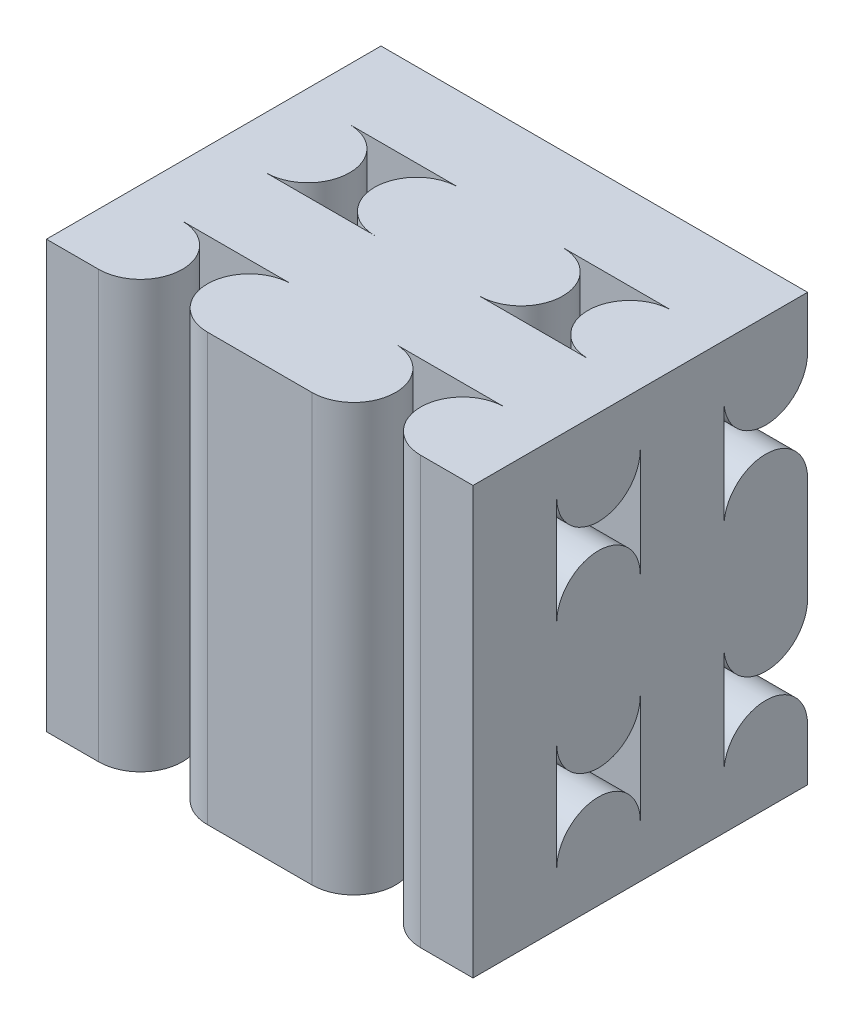
from build123d import *

# Parameters (mm, degrees)
DODANIE_WYCI_GNI_CIE1_DEPTH = 1.02
DODANIE_WYCI_GNI_CIE2_START = -0.255
DODANIE_WYCI_GNI_CIE2_DEPTH = 1.02


with BuildPart() as part:
    # Szkic1 → Dodanie-wyciągnięcie1 (new body)
    with BuildSketch(Plane(origin=(0, 0, 0), x_dir=(1, 0, 0), z_dir=(0, 1, 0))):
        with BuildLine():
            Line((-0.255, 0), (-0.13, 0))
            ThreePointArc((-0.13, 0), (-0.03, 0.1), (-0.13, 0.2))
            Line((-0.13, 0.2), (-0.255, 0.2))
            Line((-0.255, 0.2), (-0.255, 0))
        make_face()
        with BuildLine():
            Line((-0.255, 0.4), (-0.13, 0.4))
            ThreePointArc((-0.13, 0.4), (-0.03, 0.5), (-0.13, 0.6))
            Line((-0.13, 0.6), (-0.255, 0.6))
            Line((-0.255, 0.6), (-0.255, 0.4))
        make_face()
        with BuildLine():
            Line((0.255, 0.4), (0.255, 0.6))
            Line((0.255, 0.6), (0.13, 0.6))
            ThreePointArc((0.13, 0.6), (0.03, 0.5), (0.13, 0.4))
            Line((0.13, 0.4), (0.255, 0.4))
        make_face()
        with BuildLine():
            Line((0.38, 0.6), (0.255, 0.6))
            Line((0.255, 0.6), (0.255, 0.4))
            Line((0.255, 0.4), (0.38, 0.4))
            ThreePointArc((0.38, 0.4), (0.48, 0.5), (0.38, 0.6))
        make_face()
        with BuildLine():
            Line((0.38, 0.2), (0.255, 0.2))
            Line((0.255, 0.2), (0.255, 0))
            Line((0.255, 0), (0.38, 0))
            ThreePointArc((0.38, 0), (0.48, 0.1), (0.38, 0.2))
        make_face()
        with BuildLine():
            Line((0.255, 0.2), (0.13, 0.2))
            ThreePointArc((0.13, 0.2), (0.03, 0.1), (0.13, 0))
            Line((0.13, 0), (0.255, 0))
            Line((0.255, 0), (0.255, 0.2))
        make_face()
        with BuildLine():
            ThreePointArc((0.64, 0), (0.54, 0.1), (0.64, 0.2))
            Line((0.64, 0.2), (0.765, 0.2))
            Line((0.765, 0.2), (0.765, 0))
            Line((0.765, 0), (0.64, 0))
        make_face()
        with BuildLine():
            ThreePointArc((0.64, 0.4), (0.54, 0.5), (0.64, 0.6))
            Line((0.64, 0.6), (0.765, 0.6))
            Line((0.765, 0.6), (0.765, 0.4))
            Line((0.765, 0.4), (0.64, 0.4))
        make_face()
    extrude(amount=DODANIE_WYCI_GNI_CIE1_DEPTH)

    # Szkic4 → Dodanie-wyciągnięcie2 (add)
    with BuildSketch(Plane(origin=(0, 0, 0), x_dir=(0, 0, -1), z_dir=(1, 0, 0)).offset(DODANIE_WYCI_GNI_CIE2_START)):
        with BuildLine():
            Line((0.6, 1.02), (0.6, 0.895))
            ThreePointArc((0.6, 0.895), (0.7, 0.795), (0.8, 0.895))
            Line((0.8, 0.895), (0.8, 1.02))
            Line((0.8, 1.02), (0.6, 1.02))
        make_face()
        with BuildLine():
            ThreePointArc((0.8, 0.635), (0.7, 0.735), (0.6, 0.635))
            Line((0.6, 0.635), (0.6, 0.51))
            Line((0.6, 0.51), (0.8, 0.51))
            Line((0.8, 0.51), (0.8, 0.635))
        make_face()
        with BuildLine():
            Line((0.8, 0.51), (0.6, 0.51))
            Line((0.6, 0.51), (0.6, 0.385))
            ThreePointArc((0.6, 0.385), (0.7, 0.285), (0.8, 0.385))
            Line((0.8, 0.385), (0.8, 0.51))
        make_face()
        with BuildLine():
            ThreePointArc((0.6, 0.125), (0.7, 0.225), (0.8, 0.125))
            Line((0.8, 0.125), (0.8, 0))
            Line((0.8, 0), (0.6, 0))
            Line((0.6, 0), (0.6, 0.125))
        make_face()
        with BuildLine():
            ThreePointArc((0.2, 0.125), (0.3, 0.225), (0.4, 0.125))
            Line((0.4, 0.125), (0.4, 0))
            Line((0.4, 0), (0.2, 0))
            Line((0.2, 0), (0.2, 0.125))
        make_face()
        with BuildLine():
            Line((0.4, 0.51), (0.2, 0.51))
            Line((0.2, 0.51), (0.2, 0.385))
            ThreePointArc((0.2, 0.385), (0.3, 0.285), (0.4, 0.385))
            Line((0.4, 0.385), (0.4, 0.51))
        make_face()
        with BuildLine():
            Line((0.2, 0.635), (0.2, 0.51))
            Line((0.2, 0.51), (0.4, 0.51))
            Line((0.4, 0.51), (0.4, 0.635))
            ThreePointArc((0.4, 0.635), (0.3, 0.735), (0.2, 0.635))
        make_face()
        with BuildLine():
            Line((0.2, 1.02), (0.2, 0.895))
            ThreePointArc((0.2, 0.895), (0.3, 0.795), (0.4, 0.895))
            Line((0.4, 0.895), (0.4, 1.02))
            Line((0.4, 1.02), (0.2, 1.02))
        make_face()
    extrude(amount=DODANIE_WYCI_GNI_CIE2_DEPTH)


solid = part.part
